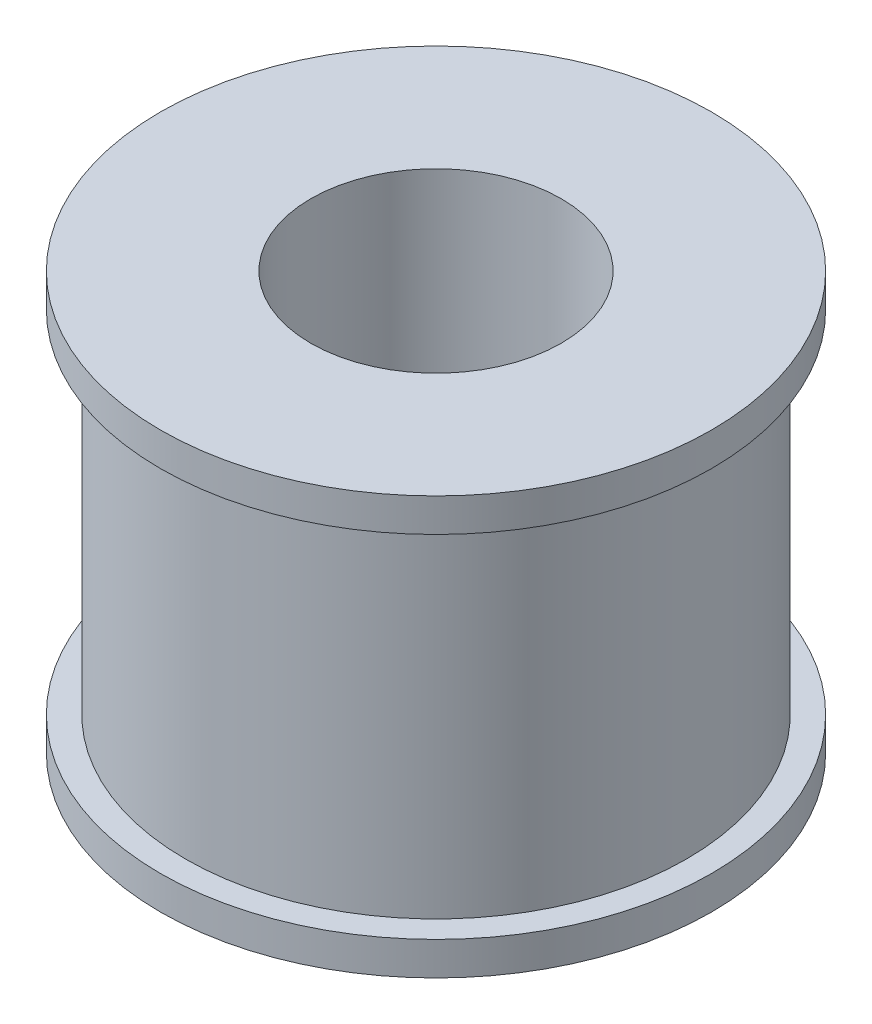
from build123d import *

# Parameters (mm, degrees)
CROQUIS1_R                 = 15
CROQUIS1_R_2               = 3
SALIENTE_EXTRUIR1_DEPTH    = 25
CROQUIS2_R                 = 16.5
CROQUIS2_R_2               = 3
SALIENTE_EXTRUIR2_DEPTH    = 2
SALIENTE_EXTRUIR3_START    = -2
CROQUIS3_R                 = 16.5
CROQUIS3_R_2               = 3
SALIENTE_EXTRUIR3_DEPTH    = 2
CORTAR_EXTRUIR1_REACH      = 36.198
CORTAR_EXTRUIR1_END_RADIUS = 15
CROQUIS4_R                 = 1.625
CROQUIS5_R                 = 7.5
CORTAR_EXTRUIR2_DEPTH      = 16


with BuildPart() as part:
    # Croquis1 → Saliente-Extruir1 (new body)
    with BuildSketch(Plane(origin=(0, 0, 0), x_dir=(1, 0, 0), z_dir=(0, 1, 0))):
        with Locations(Location((0, 0, 0), (0, 0, 270))):
            Circle(CROQUIS1_R)
        with Locations(Location((0, 0, 0), (0, 0, 270))):
            Circle(CROQUIS1_R_2, mode=Mode.SUBTRACT)
    extrude(amount=SALIENTE_EXTRUIR1_DEPTH)

    # Croquis2 → Saliente-Extruir2 (add)
    with BuildSketch(Plane.XZ):
        with Locations(Location((0, 0, 0), (0, 0, 270))):
            Circle(CROQUIS2_R)
        with Locations(Location((0, 0, 0), (0, 0, 90))):
            Circle(CROQUIS2_R_2, mode=Mode.SUBTRACT)
    extrude(amount=-SALIENTE_EXTRUIR2_DEPTH)

    # Croquis3 → Saliente-Extruir3 (add)
    with BuildSketch(Plane(origin=(0, 25, 0), x_dir=(1, 0, 0), z_dir=(0, 1, 0)).offset(SALIENTE_EXTRUIR3_START)):
        with Locations(Location((0, 0, 0), (0, 0, 90))):
            Circle(CROQUIS3_R)
        with Locations(Location((0, 0, 0), (0, 0, 270))):
            Circle(CROQUIS3_R_2, mode=Mode.SUBTRACT)
    extrude(amount=SALIENTE_EXTRUIR3_DEPTH)

    # Cortar-Extruir1: up to this cylinder (the profile starts inside it)
    cortar_extruir1_end = Plane(origin=(0, 5, 0), z_dir=(0, -1, 0)) * Cylinder(CORTAR_EXTRUIR1_END_RADIUS, 103.396, mode=Mode.PRIVATE)
    # Croquis4 → Cortar-Extruir1 (cut, up to the surface)
    with BuildSketch(Plane.XY, mode=Mode.PRIVATE) as cortar_extruir1_sk1:
        with Locations((0, 5)):
            Circle(CROQUIS4_R)
    cortar_extruir1_tool1 = extrude(cortar_extruir1_sk1.sketch, amount=-CORTAR_EXTRUIR1_REACH, mode=Mode.PRIVATE) & cortar_extruir1_end
    add(cortar_extruir1_tool1.solids().sort_by_distance((0, 5, 0))[0], mode=Mode.SUBTRACT)

    # Croquis5 → Cortar-Extruir2 (cut)
    with BuildSketch(Plane(origin=(0, 25, 0), x_dir=(1, 0, 0), z_dir=(0, 1, 0))):
        with Locations(Location((0, 0, 0), (0, 0, 270))):
            Circle(CROQUIS5_R)
    extrude(amount=-CORTAR_EXTRUIR2_DEPTH, mode=Mode.SUBTRACT)


solid = part.part
